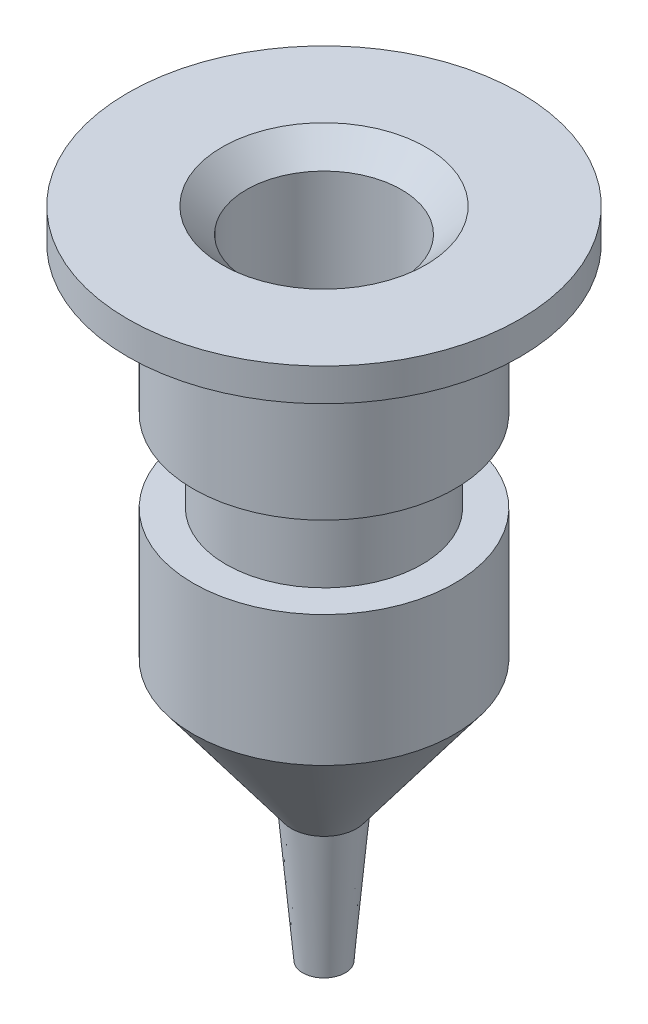
from build123d import *


with BuildPart() as part:
    # Sketch1 → Revolve1 (revolve)
    with BuildSketch(Plane(origin=(0, 0, 0), x_dir=(-1, 0, 0), z_dir=(0, 0, -1)), mode=Mode.PRIVATE) as revolve1_sk:
        Polygon((-4, 12), (-4, 8), (-1, 4), (-0.65, 0), (-0.4, 0), (-0.4, 5), (-1, 5.346410161), (-1, 10), (-2.37, 10.790969869), (-2.37, 19.25), (-3.12, 20), (-6, 20), (-6, 19), (-4, 19), (-4, 14.5), (-3, 14.5), (-3, 12), align=None)
    revolve(revolve1_sk.sketch.rotate(Axis((0, 0, 0), (0, 1, 0)), 270), axis=Axis((0, 0, 0), (0, 1, 0)))


solid = part.part
